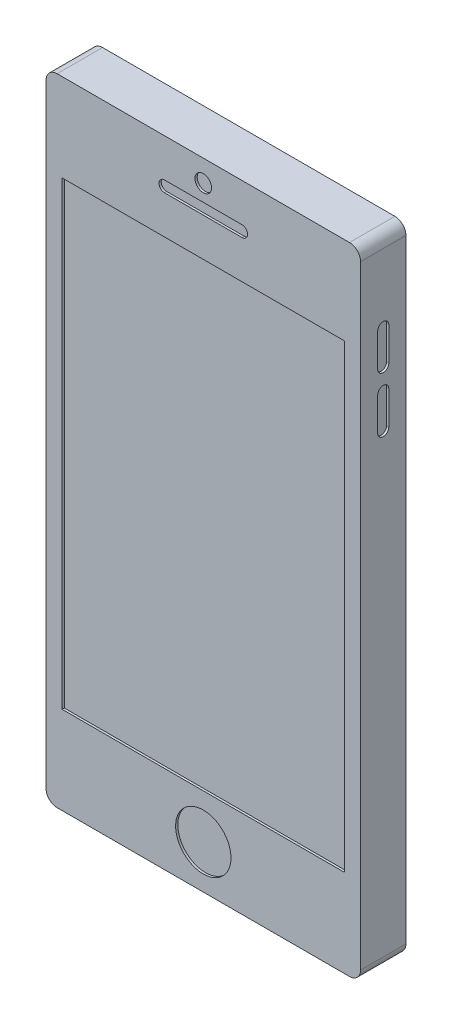
from build123d import *

# Parameters (mm, degrees)
SKETCH1_W           = 72.136
SKETCH1_H           = 145.796
BOSS_EXTRUDE1_DEPTH = 5.207
FILLET1_R           = 2.54
SKETCH2_R           = 6.35
SKETCH2_R_2         = 1.905
SKETCH2_W           = 64.77
SKETCH2_H           = 105.56555142
CUT_EXTRUDE1_DEPTH  = 0.508
SKETCH4_R           = 3.81
CUT_EXTRUDE2_DEPTH  = 0.508
CUT_EXTRUDE3_DEPTH  = 0.508


with BuildPart() as part:
    # Sketch1 → Boss-Extrude1 (new, symmetric)
    with BuildSketch(Plane.XY):
        Rectangle(SKETCH1_W, SKETCH1_H)
    extrude(amount=BOSS_EXTRUDE1_DEPTH, both=True)

    # Fillet1
    fillet1_edges = [part.edges().sort_by_distance(p)[0] for p in [
        (36.068, -72.898, 0),
        (-36.068, -72.898, 0),
        (-36.068, 72.898, 0),
        (36.068, 72.898, 0),
    ]]
    fillet(fillet1_edges, radius=FILLET1_R)

    # Sketch2 → Cut-Extrude1 (cut)
    with BuildSketch(Plane.XY.offset(5.207)):
        with Locations((0, -62.94277571)):
            Circle(SKETCH2_R)
        with Locations((0, 67.920387855)):
            Circle(SKETCH2_R_2)
        Rectangle(SKETCH2_W, SKETCH2_H)
        with BuildLine():
            Line((-8.89, 64.110387855), (8.89, 64.110387855))
            ThreePointArc((8.89, 64.110387855), (10.16, 62.840387855), (8.89, 61.570387855))
            Line((8.89, 61.570387855), (-8.89, 61.570387855))
            ThreePointArc((-8.89, 61.570387855), (-10.16, 62.840387855), (-8.89, 64.110387855))
        make_face()
    extrude(amount=-CUT_EXTRUDE1_DEPTH, mode=Mode.SUBTRACT)

    # Sketch4 → Cut-Extrude2 (cut)
    with BuildSketch(Plane(origin=(0, 0, -5.207), x_dir=(-1, 0, 0), z_dir=(0, 0, -1))):
        with Locations((25.4, 63.5)):
            Circle(SKETCH4_R)
    extrude(amount=-CUT_EXTRUDE2_DEPTH, mode=Mode.SUBTRACT)

    # Sketch5 → Cut-Extrude3 (cut)
    with BuildSketch(Plane(origin=(36.068, 0, 0), x_dir=(0, 0, -1), z_dir=(1, 0, 0))):
        with BuildLine():
            Line((1.27, 54.61), (1.27, 46.99))
            ThreePointArc((1.27, 46.99), (0, 45.72), (-1.27, 46.99))
            Line((-1.27, 46.99), (-1.27, 54.61))
            ThreePointArc((-1.27, 54.61), (0, 55.88), (1.27, 54.61))
        make_face()
        with BuildLine():
            Line((1.27, 41.91), (1.27, 34.29))
            ThreePointArc((1.27, 34.29), (0, 33.02), (-1.27, 34.29))
            Line((-1.27, 34.29), (-1.27, 41.91))
            ThreePointArc((-1.27, 41.91), (0, 43.18), (1.27, 41.91))
        make_face()
    extrude(amount=-CUT_EXTRUDE3_DEPTH, mode=Mode.SUBTRACT)


solid = part.part
